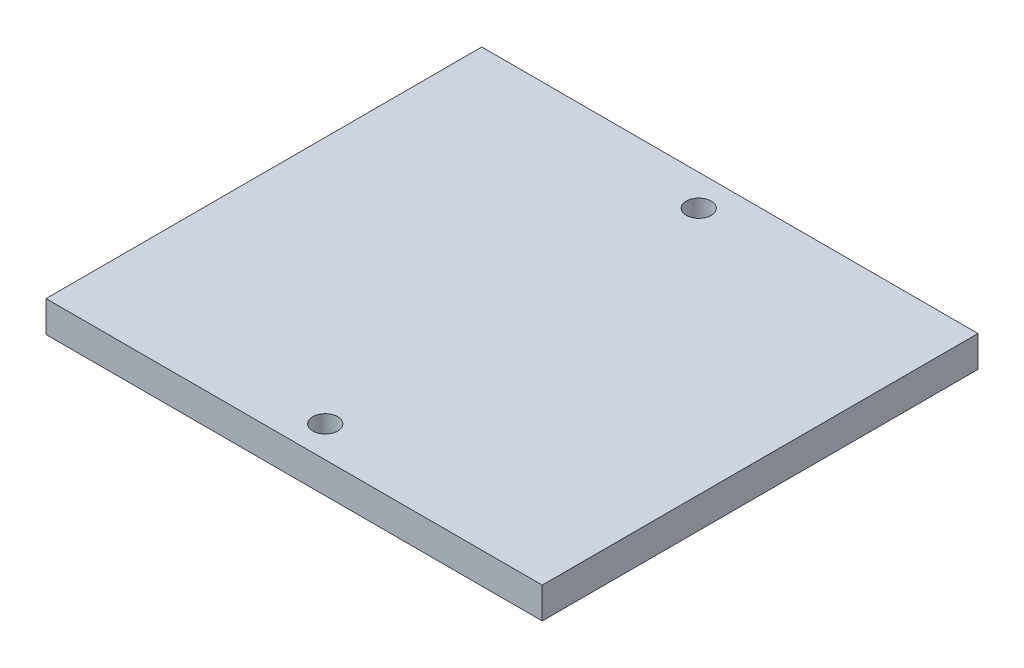
from build123d import *

# Parameters (mm, degrees)
SKETCH1_W           = 101.2375
SKETCH1_H           = 88.9
BOSS_EXTRUDE1_DEPTH = 6.35
SKETCH2_R           = 2.54
CUT_EXTRUDE1_DEPTH  = 68.66374843


with BuildPart() as part:
    # Sketch1 → Boss-Extrude1 (new body)
    with BuildSketch(Plane(origin=(0, 0, 0), x_dir=(1, 0, 0), z_dir=(0, 1, 0))):
        Rectangle(SKETCH1_W, SKETCH1_H)
    extrude(amount=BOSS_EXTRUDE1_DEPTH)

    # Sketch2 → Cut-Extrude1 (cut, through all)
    with BuildSketch(Plane(origin=(0, 6.35, 0), x_dir=(1, 0, 0), z_dir=(0, 1, 0))):
        with Locations(Location((0, 38.1, 0), (0, 0, 270))):
            Circle(SKETCH2_R)
        with Locations(Location((0, -38.1, 0), (0, 0, 90))):
            Circle(SKETCH2_R)
    extrude(amount=-CUT_EXTRUDE1_DEPTH, mode=Mode.SUBTRACT)


solid = part.part
